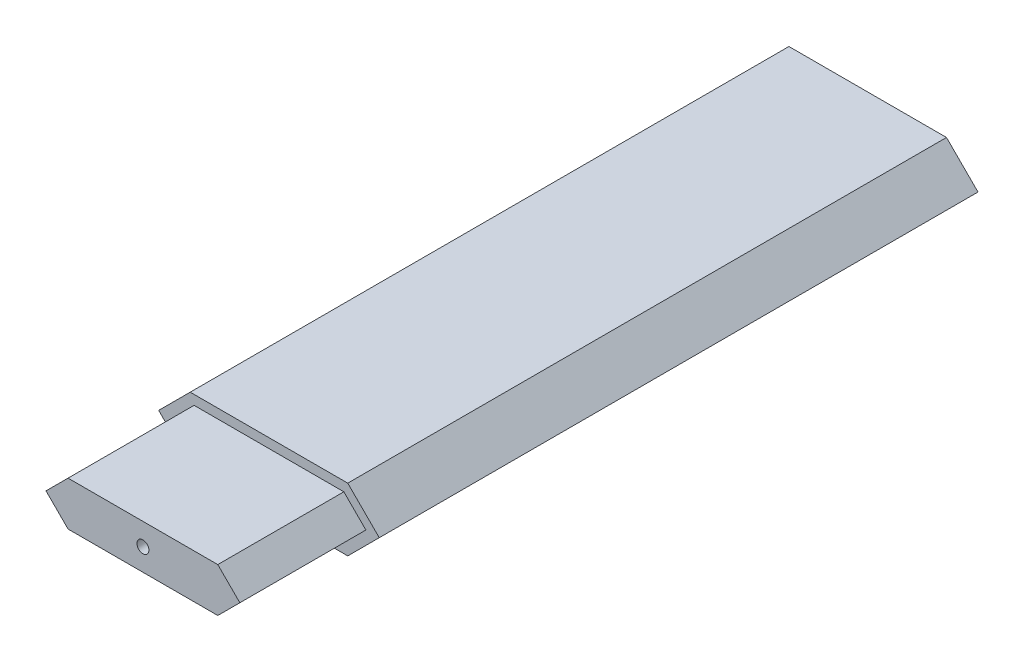
from build123d import *

# Parameters (mm, degrees)
EXTRUDE_1_DEPTH           = 18
CHAMFER_1_SIZE            = 5
CHAMFER_2_SIZE            = 5
CUT_EXTRUDE_1_DEPTH       = 8
EXTRUDE_2_REACH           = 696.741
EXTRUDE_2_END_RADIUS      = 240
EXTRUDE_3_DEPTH           = 5
EXTRUDE_4_REACH           = 929.644
EXTRUDE_4_END_RADIUS      = 232
SKETCH_10_R               = 12
CUT_EXTRUDE_7_DEPTH       = 695.872110635
CUT_EXTRUDE_7_DEPTH_BACK  = 695.872110635
SKETCH_16_OUTSIDE_W       = 362.68
SKETCH_16_OUTSIDE_H       = 1204.68
SKETCH_16_OUTSIDE_W_2     = 100
SKETCH_16_OUTSIDE_H_2     = 230
CUT_EXTRUDE_9_DEPTH       = 203.111355445
CUT_EXTRUDE_9_DEPTH_BACK  = 203.111355445
EXTRUDE_5_DEPTH           = 20
CUT_EXTRUDE_10_DEPTH      = 219.63208799
CUT_EXTRUDE_10_DEPTH_BACK = 219.63208799
SKETCH_21_R               = 1.9
EXTRUDE_START             = 15
SKETCH_29_R               = 1.9
EXTRUDE_6_DEPTH           = 15
SKETCH_33_OUTSIDE_W       = 126.318
SKETCH_33_OUTSIDE_H       = 74.662
CUT_EXTRUDE_16_DEPTH      = 40
CUT_EXTRUDE_15_DEPTH      = 41


with BuildPart() as part:
    # 草图4 → 放样1 section 0
    with BuildSketch(Plane(origin=(0, 10, 0), x_dir=(1, 0, 0), z_dir=(0, 1, 0))):
        with BuildLine():
            Line((25, 0), (-25, 0))
            Line((-25, 0), (-25, 630))
            Line((-25, 630), (0, 672.857142857))
            Line((0, 672.857142857), (25, 630))
            Line((25, 630), (25, 0))
        make_face()
    # 草图1 → 放样1 section 1
    with BuildSketch(Plane(origin=(0, 0, 0), x_dir=(1, 0, 0), z_dir=(0, 1, 0))):
        with BuildLine():
            Line((-35, 0), (35, 0))
            Line((35, 0), (35, 630))
            Line((35, 630), (0, 690))
            Line((0, 690), (-35, 630))
            Line((-35, 630), (-35, 0))
        make_face()
    loft_1 = loft()

    # 镜向1: 放样1 across plane
    add(loft_1.mirror(Plane.ZX))



with BuildPart() as body_2:
    # 草图5 → 凸台-拉伸1 (new, symmetric)
    with BuildSketch(Plane(origin=(0, 0, 0), x_dir=(1, 0, 0), z_dir=(0, 1, 0))):
        with BuildLine():
            ThreePointArc((-66.346774613, -65.189169183), (0, -55.5), (66.346774613, -65.189169183))
            ThreePointArc((66.346774613, -65.189169183), (73.061224406, -64.270510235), (76.791165228, -58.612302768))
            ThreePointArc((76.791165228, -58.612302768), (79, -30.5), (76.791165228, -2.387697232))
            ThreePointArc((76.791165228, -2.387697232), (0, -15.004503167), (-76.791165228, -2.387697232))
            ThreePointArc((-76.791165228, -2.387697232), (-79, -30.5), (-76.791165228, -58.612302768))
            ThreePointArc((-76.791165228, -58.612302768), (-73.061224406, -64.270510235), (-66.346774613, -65.189169183))
        make_face()
    extrude(amount=EXTRUDE_1_DEPTH, both=True)

    # 倒角1
    chamfer_1_edges = [body_2.edges().sort_by_distance(p)[0] for p in [
        (0, 18, 15.004503167),
        (-79, 18, 30.5),
        (-73.061224406, 18, 64.270510235),
        (0, 18, 55.5),
        (73.061224406, 18, 64.270510235),
        (0, -18, 55.5),
        (-73.061224406, -18, 64.270510235),
        (-79, -18, 30.5),
        (79, -18, 30.5),
        (73.061224406, -18, 64.270510235),
        (79, 18, 30.5),
    ]]
    chamfer(chamfer_1_edges, length=CHAMFER_1_SIZE)

    # 倒角2
    chamfer_2_edges = [body_2.edges().sort_by_distance(p)[0] for p in [
        (0, -18, 15.004503167),
    ]]
    chamfer(chamfer_2_edges, length=CHAMFER_2_SIZE)

    # 草图6 → 切除-拉伸1 (cut)
    with BuildSketch(Plane(origin=(0, 18, 0), x_dir=(1, 0, 0), z_dir=(0, 1, 0))):
        with BuildLine():
            ThreePointArc((67.221840199, -55.023712607), (68.932610365, -35.286223394), (68.335500378, -15.483731767))
            ThreePointArc((68.335500378, -15.483731767), (0, -25.004503167), (-68.335500378, -15.483731767))
            ThreePointArc((-68.335500378, -15.483731767), (-68.932610365, -35.286223394), (-67.221840199, -55.023712607))
            ThreePointArc((-67.221840199, -55.023712607), (0, -45.5), (67.221840199, -55.023712607))
        make_face()
    cut_extrude_1 = extrude(amount=-CUT_EXTRUDE_1_DEPTH, mode=Mode.SUBTRACT)

    # 镜向2: 切除-拉伸1 across plane
    add(cut_extrude_1.mirror(Plane.ZX), mode=Mode.SUBTRACT)


with BuildPart() as part_1:
    add(part.part)

    add(body_2.part)  # 凸台-拉伸2 merges body 2
    # 凸台-拉伸2: up to this cylinder (the profile starts inside it)
    extrude_2_end = Plane(origin=(0, 0, -224.995496833), z_dir=(0, -1, 0)) * Cylinder(EXTRUDE_2_END_RADIUS, 1874.482, mode=Mode.PRIVATE)
    # 草图7 → 凸台-拉伸2 (add, up to the surface)
    with BuildSketch(Plane.XY, mode=Mode.PRIVATE) as extrude_2_sk1:
        Polygon((-25.828427125, 12), (-37.828427125, 0), (-25.828427125, -12), (25.828427125, -12), (37.828427125, 0), (25.828427125, 12), align=None)
    extrude_2_tool1 = extrude(extrude_2_sk1.sketch, amount=EXTRUDE_2_REACH, mode=Mode.PRIVATE) & extrude_2_end
    add(extrude_2_tool1.solids().sort_by_distance((0, 0, 0))[0])

    # 草图8 → 凸台-拉伸3 (add)
    with BuildSketch(Plane(origin=(0, 0, 0), x_dir=(-1, 0, 0), z_dir=(0, 0, -1))):
        Polygon((25.828427125, 12), (-25.828427125, 12), (-37.828427125, 0), (-25.828427125, -12), (25.828427125, -12), (37.828427125, 0), align=None)
    extrude(amount=EXTRUDE_3_DEPTH)



with BuildPart() as body_2_2:
    # 草图9 → 旋转1 (revolve)
    with BuildSketch(Plane(origin=(0, 0, 0), x_dir=(1, 0, 0), z_dir=(0, 1, 0))):
        Polygon((0, -310), (0, -234), (-12, -234), (-22.5, -256), align=None)
    revolve(axis=Axis((0, 0, -690), (0, 0, 1)))


with BuildPart() as part_2:
    add(part_1.part)

    add(body_2_2.part)  # 凸台-拉伸4 merges body 2 2
    # 凸台-拉伸4: up to this cylinder (the profile starts inside it)
    extrude_4_end = Plane(origin=(0, 0, 287.5), z_dir=(0, -1, 0)) * Cylinder(EXTRUDE_4_END_RADIUS, 2324.288, mode=Mode.PRIVATE)
    # 草图10 → 凸台-拉伸4 (add, up to the surface)
    with BuildSketch(Plane(origin=(0, 0, 234), x_dir=(-1, 0, 0), z_dir=(0, 0, -1)), mode=Mode.PRIVATE) as extrude_4_sk1:
        with Locations(Location((0, 0, 0), (0, 0, 90))):
            Circle(SKETCH_10_R)
    extrude_4_tool1 = extrude(extrude_4_sk1.sketch, amount=EXTRUDE_4_REACH, mode=Mode.PRIVATE) & extrude_4_end
    add(extrude_4_tool1.solids().sort_by_distance((0, 0, 234))[0])

    # 草图16 outside → 切除-拉伸7 (cut, two sides: drawn at the far end of the back side and taken through both)
    with BuildSketch(Plane(origin=(0, 0, 0), x_dir=(1, 0, 0), z_dir=(0, 1, 0)).offset(-CUT_EXTRUDE_7_DEPTH_BACK)):
        with Locations((0, 190)):
            Rectangle(SKETCH_16_OUTSIDE_W, SKETCH_16_OUTSIDE_H)
        with Locations((0, 80)):
            Rectangle(SKETCH_16_OUTSIDE_W_2, SKETCH_16_OUTSIDE_H_2, mode=Mode.SUBTRACT)
    extrude(amount=CUT_EXTRUDE_7_DEPTH + CUT_EXTRUDE_7_DEPTH_BACK, mode=Mode.SUBTRACT)

    # 草图19 → 切除-拉伸9 (cut, two sides: drawn at the far end of the back side and taken through both)
    with BuildSketch(Plane(origin=(0, 0, 0), x_dir=(1, 0, 0), z_dir=(0, 1, 0)).offset(-CUT_EXTRUDE_9_DEPTH_BACK)):
        with BuildLine():
            Line((-50, -9.738395054), (-50, -35))
            Line((-50, -35), (50, -35))
            Line((50, -35), (50, -9.738395054))
            ThreePointArc((50, -9.738395054), (0, -15.004503167), (-50, -9.738395054))
        make_face()
    extrude(amount=CUT_EXTRUDE_9_DEPTH + CUT_EXTRUDE_9_DEPTH_BACK, mode=Mode.SUBTRACT)

    # 草图20 → 凸台-拉伸5 (add)
    with BuildSketch(Plane.XY):
        Polygon((-25.828427125, 12), (-37.828427125, 0), (-25.828427125, -12), (25.828427125, -12), (37.828427125, 0), (25.828427125, 12), align=None)
    extrude(amount=EXTRUDE_5_DEPTH)

    # 草图21 → 切除-拉伸10 (cut, two sides: drawn at the far end of the back side and taken through both)
    with BuildSketch(Plane.XY.offset(20).offset(-CUT_EXTRUDE_10_DEPTH_BACK)):
        Circle(SKETCH_21_R)
    extrude(amount=CUT_EXTRUDE_10_DEPTH + CUT_EXTRUDE_10_DEPTH_BACK, mode=Mode.SUBTRACT)

    # 草图29 → 凸台-拉伸6 (add)
    with BuildSketch(Plane.XY.offset(20).offset(EXTRUDE_START)):
        Polygon((25.828427125, 12), (-25.828427125, 12), (-37.828427125, 0), (-25.828427125, -12), (25.828427125, -12), (37.828427125, 0), align=None)
        Circle(SKETCH_29_R, mode=Mode.SUBTRACT)
    extrude(amount=-EXTRUDE_6_DEPTH)

    # 草图33 outside → 切除-拉伸16 (cut)
    with BuildSketch(Plane.XY.offset(35)):
        Rectangle(SKETCH_33_OUTSIDE_W, SKETCH_33_OUTSIDE_H)
        Polygon((30.757359313, 0), (23.757359313, 7), (-23.757359313, 7), (-30.757359313, 0), (-23.757359313, -7), (23.757359313, -7), align=None, mode=Mode.SUBTRACT)
    extrude(amount=-CUT_EXTRUDE_16_DEPTH, mode=Mode.SUBTRACT)

    # 草图31 → 切除-拉伸15 (cut)
    with BuildSketch(Plane(origin=(0, 0, -195), x_dir=(-1, 0, 0), z_dir=(0, 0, -1))):
        Polygon((-28.211774901, 0), (-23.011774901, -5.2), (23.011774901, -5.2), (28.211774901, 0), (23.011774901, 5.2), (-23.011774901, 5.2), align=None)
    extrude(amount=-CUT_EXTRUDE_15_DEPTH, mode=Mode.SUBTRACT)


solid = part_2.part
